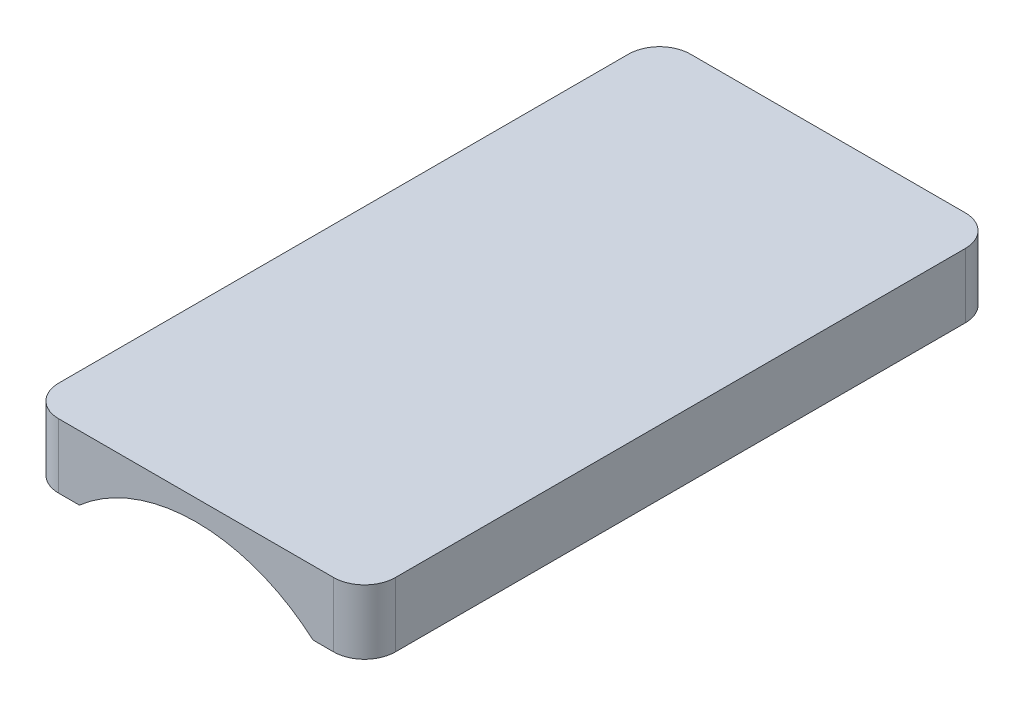
from build123d import *

# Parameters (mm, degrees)
SKETCH1_W               = 61.25
SKETCH1_H               = 6.25
BOSS_EXTRUDE1_DEPTH     = 32.65
CUT_EXTRUDE1_DEPTH      = 70.689651312
CUT_EXTRUDE1_DEPTH_BACK = 35
CUT_EXTRUDE2_DEPTH      = 10
FILLET1_R               = 3


with BuildPart() as part:
    # Sketch1 → Boss-Extrude1 (new body)
    with BuildSketch(Plane(origin=(0, 0, 0), x_dir=(0, 0, -1), z_dir=(1, 0, 0))):
        with Locations((30.625, 3.125)):
            Rectangle(SKETCH1_W, SKETCH1_H)
    extrude(amount=BOSS_EXTRUDE1_DEPTH)

    # Sketch2 → Cut-Extrude1 (cut, two sides: drawn at the far end of the back side and taken through both)
    with BuildSketch(Plane.XY.offset(-CUT_EXTRUDE1_DEPTH_BACK)):
        with BuildLine():
            Line((5, 0), (27.65, 0))
            ThreePointArc((27.65, 0), (16.325, 4.25), (5, 0))
        make_face()
    extrude(amount=CUT_EXTRUDE1_DEPTH + CUT_EXTRUDE1_DEPTH_BACK, mode=Mode.SUBTRACT)

    # Sketch3 → Cut-Extrude2 (cut)
    with BuildSketch(Plane(origin=(0, 0, -61.25), x_dir=(-1, 0, 0), z_dir=(0, 0, -1))):
        Polygon((-11.175, 1), (-11.175, 5.25), (-21.475, 5.25), (-19.35, 3.125), (-21.475, 1), align=None)
    extrude(amount=-CUT_EXTRUDE2_DEPTH, mode=Mode.SUBTRACT)

    # Fillet1
    fillet1_edges = [part.edges().sort_by_distance(p)[0] for p in [
        (32.65, 3.125, 0),
        (0, 3.125, 0),
        (0, 3.125, -61.25),
        (32.65, 3.125, -61.25),
    ]]
    fillet(fillet1_edges, radius=FILLET1_R)


solid = part.part
